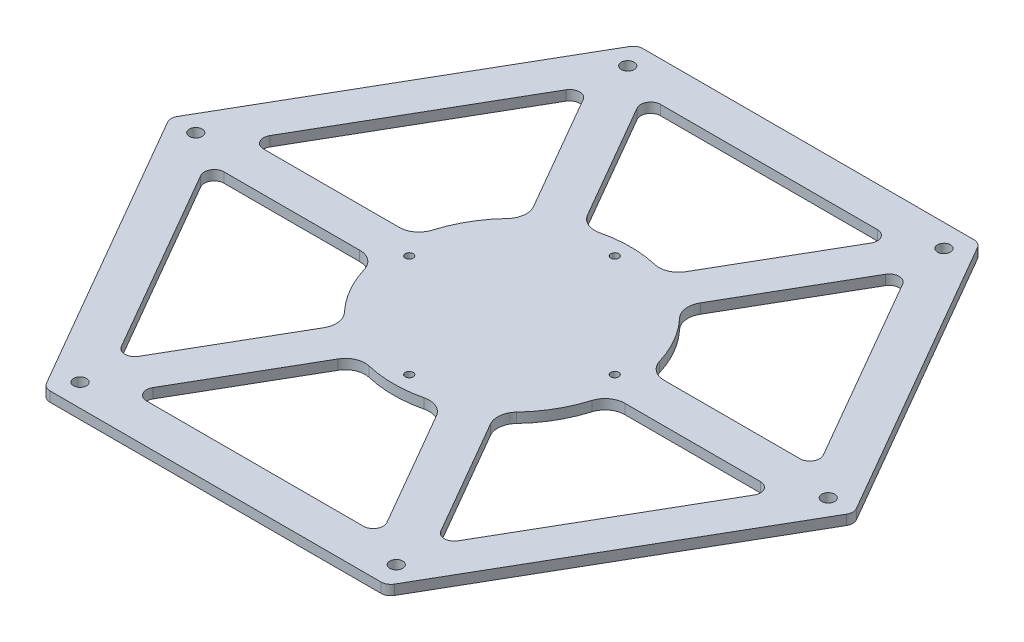
from build123d import *

# Parameters (mm, degrees)
SKETCH1_R           = 3.25
SKETCH1_R_2         = 2
BOSS_EXTRUDE1_DEPTH = 5
FILLET2_R           = 10


with BuildPart() as part:
    # Sketch1 → Boss-Extrude1 (new body)
    with BuildSketch(Plane(origin=(0, 0, 0), x_dir=(1, 0, 0), z_dir=(0, 1, 0))):
        with BuildLine():
            ThreePointArc((171.761705084, -2.5), (172.431578065, 0), (171.761705084, 2.5))
            Line((171.761705084, 2.5), (88.045916051, 147.5))
            ThreePointArc((88.045916051, 147.5), (86.215789032, 149.330127019), (83.715789032, 150))
            Line((83.715789032, 150), (-83.715789032, 150))
            ThreePointArc((-83.715789032, 150), (-86.215789032, 149.330127019), (-88.045916051, 147.5))
            Line((-88.045916051, 147.5), (-171.761705084, 2.5))
            ThreePointArc((-171.761705084, 2.5), (-172.431578065, 0), (-171.761705084, -2.5))
            Line((-171.761705084, -2.5), (-88.045916051, -147.5))
            ThreePointArc((-88.045916051, -147.5), (-86.215789032, -149.330127019), (-83.715789032, -150))
            Line((-83.715789032, -150), (83.715789032, -150))
            ThreePointArc((83.715789032, -150), (86.215789032, -149.330127019), (88.045916051, -147.5))
            Line((88.045916051, -147.5), (171.761705084, -2.5))
        make_face()
        with Locations(Location((-80, -138.564064606, 0), (0, 0, 270))):
            Circle(SKETCH1_R, mode=Mode.SUBTRACT)
        with BuildLine():
            Line((20.920144878, -56.23475383), (59.178402592, -122.5))
            ThreePointArc((59.178402592, -122.5), (59.178402592, -127.5), (54.848275573, -130))
            Line((54.848275573, -130), (-54.848275573, -130))
            ThreePointArc((-54.848275573, -130), (-59.178402592, -127.5), (-59.178402592, -122.5))
            Line((-59.178402592, -122.5), (-20.920144878, -56.23475383))
            ThreePointArc((-20.920144878, -56.23475383), (0, -60), (20.920144878, -56.23475383))
        make_face(mode=Mode.SUBTRACT)
        with BuildLine():
            Line((-38.240652953, -46.23475383), (-76.498910668, -112.5))
            ThreePointArc((-76.498910668, -112.5), (-80.829037687, -115), (-85.159164705, -112.5))
            Line((-85.159164705, -112.5), (-140.007440278, -17.5))
            ThreePointArc((-140.007440278, -17.5), (-140.007440278, -12.5), (-135.67731326, -10))
            Line((-135.67731326, -10), (-59.160797831, -10))
            ThreePointArc((-59.160797831, -10), (-51.961524227, -30), (-38.240652953, -46.23475383))
        make_face(mode=Mode.SUBTRACT)
        with Locations(Location((-160, 0, 0), (0, 0, 270))):
            Circle(SKETCH1_R, mode=Mode.SUBTRACT)
        with Locations(Location((0, -52, 0), (0, 0, 270))):
            Circle(SKETCH1_R_2, mode=Mode.SUBTRACT)
        with Locations(Location((-52, 0, 0), (0, 0, 270))):
            Circle(SKETCH1_R_2, mode=Mode.SUBTRACT)
        with Locations(Location((80, -138.564064606, 0), (0, 0, 270))):
            Circle(SKETCH1_R, mode=Mode.SUBTRACT)
        with Locations(Location((52, 0, 0), (0, 0, 270))):
            Circle(SKETCH1_R_2, mode=Mode.SUBTRACT)
        with BuildLine():
            ThreePointArc((85.159164705, -112.5), (80.829037687, -115), (76.498910668, -112.5))
            Line((76.498910668, -112.5), (38.240652953, -46.23475383))
            ThreePointArc((38.240652953, -46.23475383), (51.961524227, -30), (59.160797831, -10))
            Line((59.160797831, -10), (135.67731326, -10))
            ThreePointArc((135.67731326, -10), (140.007440278, -12.5), (140.007440278, -17.5))
            Line((140.007440278, -17.5), (85.159164705, -112.5))
        make_face(mode=Mode.SUBTRACT)
        with BuildLine():
            Line((-59.160797831, 10), (-135.67731326, 10))
            ThreePointArc((-135.67731326, 10), (-140.007440278, 12.5), (-140.007440278, 17.5))
            Line((-140.007440278, 17.5), (-85.159164705, 112.5))
            ThreePointArc((-85.159164705, 112.5), (-80.829037687, 115), (-76.498910668, 112.5))
            Line((-76.498910668, 112.5), (-38.240652953, 46.23475383))
            ThreePointArc((-38.240652953, 46.23475383), (-51.961524227, 30), (-59.160797831, 10))
        make_face(mode=Mode.SUBTRACT)
        with Locations(Location((0, 52, 0), (0, 0, 270))):
            Circle(SKETCH1_R_2, mode=Mode.SUBTRACT)
        with BuildLine():
            Line((59.178402592, 122.5), (20.920144878, 56.23475383))
            ThreePointArc((20.920144878, 56.23475383), (0, 60), (-20.920144878, 56.23475383))
            Line((-20.920144878, 56.23475383), (-59.178402592, 122.5))
            ThreePointArc((-59.178402592, 122.5), (-59.178402592, 127.5), (-54.848275573, 130))
            Line((-54.848275573, 130), (54.848275573, 130))
            ThreePointArc((54.848275573, 130), (59.178402592, 127.5), (59.178402592, 122.5))
        make_face(mode=Mode.SUBTRACT)
        with Locations(Location((-80, 138.564064606, 0), (0, 0, 270))):
            Circle(SKETCH1_R, mode=Mode.SUBTRACT)
        with Locations(Location((160, 0, 0), (0, 0, 270))):
            Circle(SKETCH1_R, mode=Mode.SUBTRACT)
        with BuildLine():
            Line((135.67731326, 10), (59.160797831, 10))
            ThreePointArc((59.160797831, 10), (51.961524227, 30), (38.240652953, 46.23475383))
            Line((38.240652953, 46.23475383), (76.498910668, 112.5))
            ThreePointArc((76.498910668, 112.5), (80.829037687, 115), (85.159164705, 112.5))
            Line((85.159164705, 112.5), (140.007440278, 17.5))
            ThreePointArc((140.007440278, 17.5), (140.007440278, 12.5), (135.67731326, 10))
        make_face(mode=Mode.SUBTRACT)
        with Locations(Location((80, 138.564064606, 0), (0, 0, 270))):
            Circle(SKETCH1_R, mode=Mode.SUBTRACT)
    extrude(amount=BOSS_EXTRUDE1_DEPTH)

    # Fillet2
    fillet2_edges = [part.edges().sort_by_distance(p)[0] for p in [
        (-59.160797831, 2.5, -10),
        (-59.160797831, 2.5, 10),
        (-38.240652953, 2.5, 46.23475383),
        (-20.920144878, 2.5, 56.23475383),
        (20.920144878, 2.5, 56.23475383),
        (38.240652953, 2.5, 46.23475383),
        (59.160797831, 2.5, 10),
        (59.160797831, 2.5, -10),
        (38.240652953, 2.5, -46.23475383),
        (20.920144878, 2.5, -56.23475383),
        (-20.920144878, 2.5, -56.23475383),
        (-38.240652953, 2.5, -46.23475383),
    ]]
    fillet(fillet2_edges, radius=FILLET2_R)


solid = part.part
